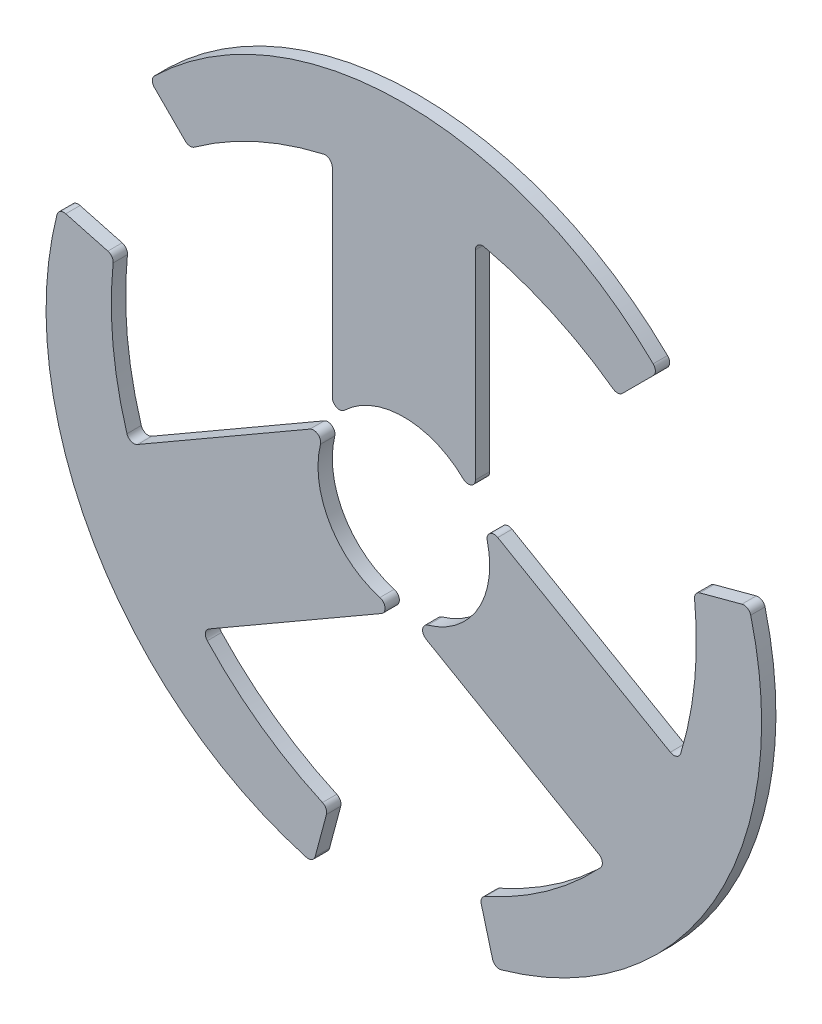
from build123d import *

# Parameters (mm, degrees)
BOSS_EXTRUDE2_DEPTH   = 5
BOSS_EXTRUDE2_2_DEPTH = 5
BOSS_EXTRUDE2_3_DEPTH = 5


with BuildPart() as part:
    # Sketch1 → Boss-Extrude2 (new body)
    with BuildSketch(Plane.XY):
        with BuildLine():
            ThreePointArc((-141.289999118, 78.804960004), (-141.334529419, 53.935289488), (-136.454710083, 29.549025778))
            ThreePointArc((-136.454710083, 29.549025778), (-134.980013747, 27.954750711), (-132.81426596, 28.115930093))
            Line((-132.81426596, 28.115930093), (-72.526189959, 62.923267002))
            ThreePointArc((-72.526189959, 62.923267002), (-69.774713456, 62.757095263), (-68.848608602, 60.160835301))
            ThreePointArc((-68.848608602, 60.160835301), (-65.698394434, 37.992417004), (-48.075088111, 24.180042358))
            ThreePointArc((-48.075088111, 24.180042358), (-46.289713456, 22.079882047), (-47.52154276, 19.613947629))
            Line((-47.52154276, 19.613947629), (-107.809618762, -15.19338928))
            ThreePointArc((-107.809618762, -15.19338928), (-109.032078095, -16.988392191), (-108.388743554, -19.062654214))
            ThreePointArc((-108.388743554, -19.062654214), (-89.709529345, -35.481833579), (-68.149497745, -47.878104465))
            ThreePointArc((-68.149497745, -47.878104465), (-66.915609368, -49.086045475), (-66.759023055, -50.805662507))
            Line((-66.759023055, -50.805662507), (-70.700152367, -65.514157338))
            ThreePointArc((-70.700152367, -65.514157338), (-71.88050884, -67.041072287), (-73.79654519, -67.272406189))
            ThreePointArc((-73.79654519, -67.272406189), (-147.970807793, -9.507582996), (-160.909480822, 83.611624322))
            ThreePointArc((-160.909480822, 83.611624322), (-159.751121611, 85.155293524), (-157.838596239, 85.414054741))
            Line((-157.838596239, 85.414054741), (-143.130101408, 81.47292543))
            ThreePointArc((-143.130101408, 81.47292543), (-141.71916253, 80.477509189), (-141.289999118, 78.804960004))
        make_face()
    extrude(amount=BOSS_EXTRUDE2_DEPTH)


with BuildPart() as body_2:
    # Sketch1 → Boss-Extrude2 2 (new body)
    with BuildSketch(Plane.XY):
        with BuildLine():
            ThreePointArc((-11.285766896, -47.878104465), (10.274264705, -35.481833579), (28.953478913, -19.062654214))
            ThreePointArc((28.953478913, -19.062654214), (29.596813454, -16.988392191), (28.374354121, -15.19338928))
            Line((28.374354121, -15.19338928), (-31.91372188, 19.613947629))
            ThreePointArc((-31.91372188, 19.613947629), (-33.145551185, 22.079882047), (-31.360176529, 24.180042358))
            ThreePointArc((-31.360176529, 24.180042358), (-13.736870207, 37.992417004), (-10.586656039, 60.160835301))
            ThreePointArc((-10.586656039, 60.160835301), (-9.660551185, 62.757095263), (-6.909074682, 62.923267002))
            Line((-6.909074682, 62.923267002), (53.37900132, 28.115930093))
            ThreePointArc((53.37900132, 28.115930093), (55.544749107, 27.954750711), (57.019445442, 29.549025778))
            ThreePointArc((57.019445442, 29.549025778), (61.899264778, 53.935289488), (61.854734477, 78.804960004))
            ThreePointArc((61.854734477, 78.804960004), (62.28389789, 80.477509189), (63.694836768, 81.47292543))
            Line((63.694836768, 81.47292543), (78.403331598, 85.414054741))
            ThreePointArc((78.403331598, 85.414054741), (80.31585697, 85.155293524), (81.474216181, 83.611624322))
            ThreePointArc((81.474216181, 83.611624322), (68.535543153, -9.507582996), (-5.638719451, -67.272406189))
            ThreePointArc((-5.638719451, -67.272406189), (-7.5547558, -67.041072287), (-8.735112274, -65.514157338))
            Line((-8.735112274, -65.514157338), (-12.676241586, -50.805662507))
            ThreePointArc((-12.676241586, -50.805662507), (-12.519655273, -49.086045475), (-11.285766896, -47.878104465))
        make_face()
    extrude(amount=BOSS_EXTRUDE2_2_DEPTH)


with BuildPart() as body_3:
    # Sketch1 → Boss-Extrude2 3 (new body)
    with BuildSketch(Plane.XY):
        with BuildLine():
            ThreePointArc((-11.651665791, 148.490879447), (-13.769696668, 148.010892491), (-14.712985122, 146.054710198))
            Line((-14.712985122, 146.054710198), (-14.712985122, 76.440036381))
            ThreePointArc((-14.712985122, 76.440036381), (-16.23263232, 74.140273701), (-18.944111829, 74.636373352))
            ThreePointArc((-18.944111829, 74.636373352), (-39.71763232, 82.992417004), (-60.491152811, 74.636373352))
            ThreePointArc((-60.491152811, 74.636373352), (-63.20263232, 74.140273701), (-64.722279519, 76.440036381))
            Line((-64.722279519, 76.440036381), (-64.722279519, 146.054710198))
            ThreePointArc((-64.722279519, 146.054710198), (-65.665567973, 148.010892491), (-67.783598849, 148.490879447))
            ThreePointArc((-67.783598849, 148.490879447), (-91.342632394, 140.523795103), (-112.858133693, 128.050395473))
            ThreePointArc((-112.858133693, 128.050395473), (-114.521185483, 127.585787298), (-116.088710674, 128.309988089))
            Line((-116.088710674, 128.309988089), (-126.856076193, 139.077353608))
            ThreePointArc((-126.856076193, 139.077353608), (-127.588245091, 140.863029774), (-126.830567952, 142.638032879))
            ThreePointArc((-126.830567952, 142.638032879), (-39.71763232, 177.992417004), (47.395303312, 142.638032879))
            ThreePointArc((47.395303312, 142.638032879), (48.15298045, 140.863029774), (47.420811552, 139.077353608))
            Line((47.420811552, 139.077353608), (36.653446033, 128.309988089))
            ThreePointArc((36.653446033, 128.309988089), (35.085920842, 127.585787298), (33.422869053, 128.050395473))
            ThreePointArc((33.422869053, 128.050395473), (11.907367753, 140.523795103), (-11.651665791, 148.490879447))
        make_face()
    extrude(amount=BOSS_EXTRUDE2_3_DEPTH)


solid = Compound([part.part, body_2.part, body_3.part])
